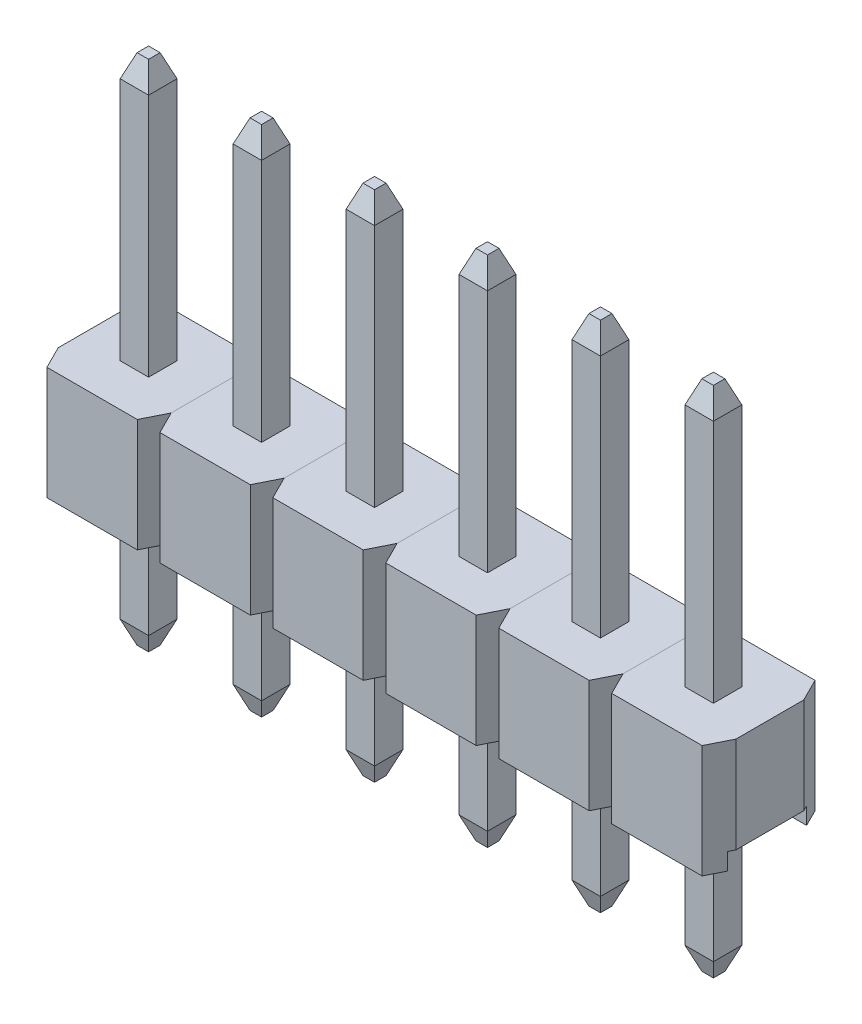
from build123d import *
from OCP.BRepFilletAPI import BRepFilletAPI_MakeChamfer

# Parameters (mm, degrees)
SKETCH1_W            = 2.54
SKETCH1_H            = 2.54
MAIN_BODY_DEPTH      = 2.54
SKETCH3_W            = 1.778
SKETCH3_H            = 0.381
CUT_GROOVE_DEPTH     = 5.399409051
CUT_CORNERS_DEPTH    = 5.399409051
PIN_START            = -5.54
SKETCH2_W            = 0.64
SKETCH2_H            = 0.64
PIN_DEPTH            = 11.54
CHAMFER2_SIZE        = 0.1905
CHAMFER2_SIZE2       = 0.508
CHAMFER1_SIZE        = 0.508
CHAMFER1_SIZE2       = 0.1905
PATTERN_SLEEVE_COUNT = 6
PATTERN_SLEEVE_PITCH = 2.54
PATTERN_PINS_COUNT   = 6
PATTERN_PINS_PITCH   = 2.54


with BuildPart() as part:
    # Sketch1 → Main Body (new body)
    with BuildSketch(Plane(origin=(0, 0, 0), x_dir=(1, 0, 0), z_dir=(0, 1, 0))):
        with Locations((1.27, 1.27)):
            Rectangle(SKETCH1_W, SKETCH1_H)
    extrude(amount=MAIN_BODY_DEPTH)

    # Sketch3 → cut groove (cut, through all)
    with BuildSketch(Plane.ZY):
        with Locations((-1.27, 0.1905)):
            Rectangle(SKETCH3_W, SKETCH3_H)
    extrude(amount=-CUT_GROOVE_DEPTH, mode=Mode.SUBTRACT)

    # Sketch4 → cut corners (cut, through all)
    with BuildSketch(Plane(origin=(0, 2.54, 0), x_dir=(1, 0, 0), z_dir=(0, 1, 0))):
        Polygon((0.254, 2.54), (0, 2.54), (0, 2.032), align=None)
        Polygon((2.54, 2.54), (2.286, 2.54), (2.54, 2.032), align=None)
        Polygon((0.254, 0), (0, 0.508), (0, 0), align=None)
        Polygon((2.54, 0), (2.286, 0), (2.54, 0.508), align=None)
    extrude(amount=-CUT_CORNERS_DEPTH, mode=Mode.SUBTRACT)


with BuildPart() as body_2:
    # Sketch2 → Pin (new body)
    with BuildSketch(Plane(origin=(0, 2.54, 0), x_dir=(1, 0, 0), z_dir=(0, 1, 0)).offset(PIN_START)):
        with Locations((1.27, 1.27)):
            Rectangle(SKETCH2_W, SKETCH2_H)
    extrude(amount=PIN_DEPTH)

    # Chamfer2
    chamfer2_edges = [body_2.edges().sort_by_distance(p)[0] for p in [
        (1.27, -3, -0.95),
        (1.59, -3, -1.27),
        (1.27, -3, -1.59),
        (0.95, -3, -1.27),
    ]]
    chamfer2_side = [body_2.faces().sort_by_distance(p)[0] for p in [
        (1.27, -3, -1.27),
    ]]
    chamfer(chamfer2_edges, length=CHAMFER2_SIZE, length2=CHAMFER2_SIZE2, reference=chamfer2_side[0])

    # Chamfer1: one chamfer whose edges measure the first distance from different faces: ONE call of the kernel's chamfer builder (chamfer() names one face for all edges)
    chamfer1_edges_1 = [body_2.edges().sort_by_distance(p)[0] for p in [
        (1.27, 8.54, -0.95),
    ]]
    chamfer1_side_1 = [body_2.faces().sort_by_distance(p)[0] for p in [
        (1.27, 3.024, -0.95),
    ]]
    chamfer1_edges_2 = [body_2.edges().sort_by_distance(p)[0] for p in [
        (1.59, 8.54, -1.27),
    ]]
    chamfer1_side_2 = [body_2.faces().sort_by_distance(p)[0] for p in [
        (1.59, 3.024, -1.27),
    ]]
    chamfer1_edges_3 = [body_2.edges().sort_by_distance(p)[0] for p in [
        (1.27, 8.54, -1.59),
    ]]
    chamfer1_side_3 = [body_2.faces().sort_by_distance(p)[0] for p in [
        (1.27, 3.024, -1.59),
    ]]
    chamfer1_edges_4 = [body_2.edges().sort_by_distance(p)[0] for p in [
        (0.95, 8.54, -1.27),
    ]]
    chamfer1_side_4 = [body_2.faces().sort_by_distance(p)[0] for p in [
        (0.95, 3.024, -1.27),
    ]]
    chamfer1 = BRepFilletAPI_MakeChamfer(body_2.part.solid().wrapped)
    for e in chamfer1_edges_1:
        chamfer1.Add(CHAMFER1_SIZE, CHAMFER1_SIZE2, e.wrapped, chamfer1_side_1[0].wrapped)  # the first distance lies on this face
    for e in chamfer1_edges_2:
        chamfer1.Add(CHAMFER1_SIZE, CHAMFER1_SIZE2, e.wrapped, chamfer1_side_2[0].wrapped)  # the first distance lies on this face
    for e in chamfer1_edges_3:
        chamfer1.Add(CHAMFER1_SIZE, CHAMFER1_SIZE2, e.wrapped, chamfer1_side_3[0].wrapped)  # the first distance lies on this face
    for e in chamfer1_edges_4:
        chamfer1.Add(CHAMFER1_SIZE, CHAMFER1_SIZE2, e.wrapped, chamfer1_side_4[0].wrapped)  # the first distance lies on this face
    add(Compound.cast(chamfer1.Shape()), mode=Mode.REPLACE)


with BuildPart() as pattern_sleeve_1:
    # pattern SLEEVE: pattern copy
    add(part.part.moved(Location(Vector(-1, 0, 0) * (1 * PATTERN_SLEEVE_PITCH))))


with BuildPart() as pattern_sleeve_2:
    # pattern SLEEVE: pattern copy
    add(part.part.moved(Location(Vector(-1, 0, 0) * (2 * PATTERN_SLEEVE_PITCH))))


with BuildPart() as pattern_sleeve_3:
    # pattern SLEEVE: pattern copy
    add(part.part.moved(Location(Vector(-1, 0, 0) * (3 * PATTERN_SLEEVE_PITCH))))


with BuildPart() as pattern_sleeve_4:
    # pattern SLEEVE: pattern copy
    add(part.part.moved(Location(Vector(-1, 0, 0) * (4 * PATTERN_SLEEVE_PITCH))))


with BuildPart() as pattern_sleeve_5:
    # pattern SLEEVE: pattern copy
    add(part.part.moved(Location(Vector(-1, 0, 0) * (5 * PATTERN_SLEEVE_PITCH))))


with BuildPart() as pattern_pins_1:
    # pattern PINS: pattern copy
    add(body_2.part.moved(Location(Vector(-1, 0, 0) * (1 * PATTERN_PINS_PITCH))))


with BuildPart() as pattern_pins_2:
    # pattern PINS: pattern copy
    add(body_2.part.moved(Location(Vector(-1, 0, 0) * (2 * PATTERN_PINS_PITCH))))


with BuildPart() as pattern_pins_3:
    # pattern PINS: pattern copy
    add(body_2.part.moved(Location(Vector(-1, 0, 0) * (3 * PATTERN_PINS_PITCH))))


with BuildPart() as pattern_pins_4:
    # pattern PINS: pattern copy
    add(body_2.part.moved(Location(Vector(-1, 0, 0) * (4 * PATTERN_PINS_PITCH))))


with BuildPart() as pattern_pins_5:
    # pattern PINS: pattern copy
    add(body_2.part.moved(Location(Vector(-1, 0, 0) * (5 * PATTERN_PINS_PITCH))))


solid = Compound([part.part, body_2.part, pattern_sleeve_1.part, pattern_sleeve_2.part, pattern_sleeve_3.part, pattern_sleeve_4.part, pattern_sleeve_5.part, pattern_pins_1.part, pattern_pins_2.part, pattern_pins_3.part, pattern_pins_4.part, pattern_pins_5.part])
